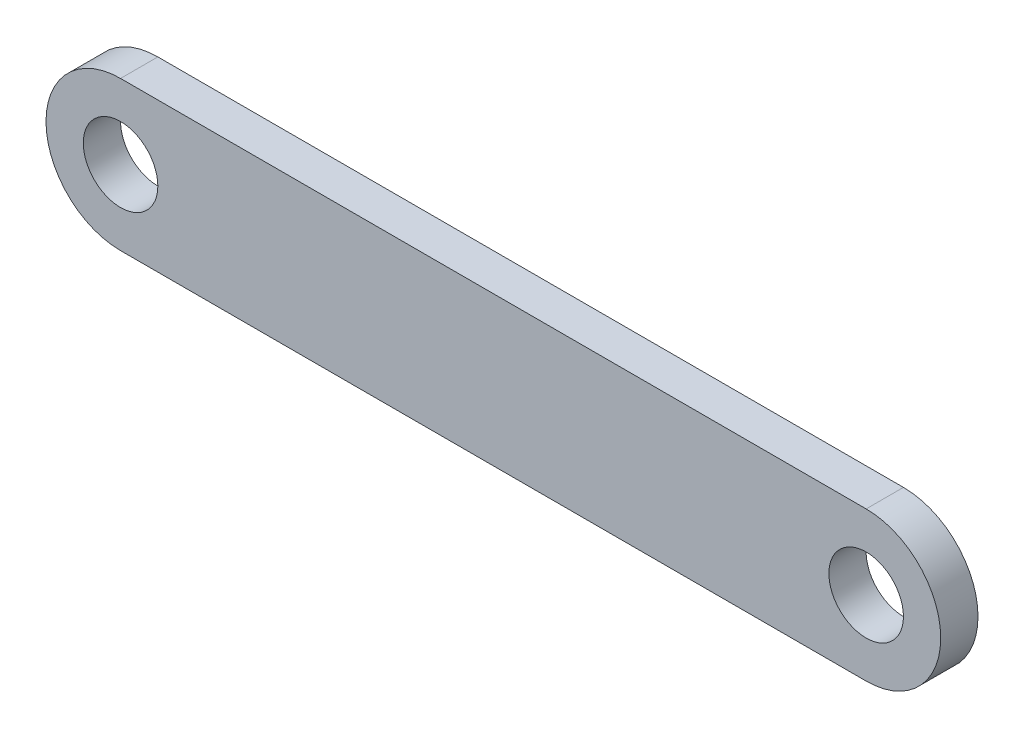
from build123d import *

# Parameters (mm, degrees)
IZIM1_R                     = 5
Y_KSEKLIK_EKSTR_ZYON1_DEPTH = 5


with BuildPart() as part:
    # Çizim1 → Yükseklik-Ekstrüzyon1 (new body)
    with BuildSketch(Plane.XY):
        with BuildLine():
            Line((-38.69815392, 12.886597938), (61.30184608, 12.886597938))
            ThreePointArc((61.30184608, 12.886597938), (71.30184608, 2.886597938), (61.30184608, -7.113402062))
            Line((61.30184608, -7.113402062), (-38.69815392, -7.113402062))
            ThreePointArc((-38.69815392, -7.113402062), (-48.69815392, 2.886597938), (-38.69815392, 12.886597938))
        make_face()
        with Locations((-38.69815392, 2.886597938)):
            Circle(IZIM1_R, mode=Mode.SUBTRACT)
        with Locations((61.30184608, 2.886597938)):
            Circle(IZIM1_R, mode=Mode.SUBTRACT)
    extrude(amount=Y_KSEKLIK_EKSTR_ZYON1_DEPTH)


solid = part.part
